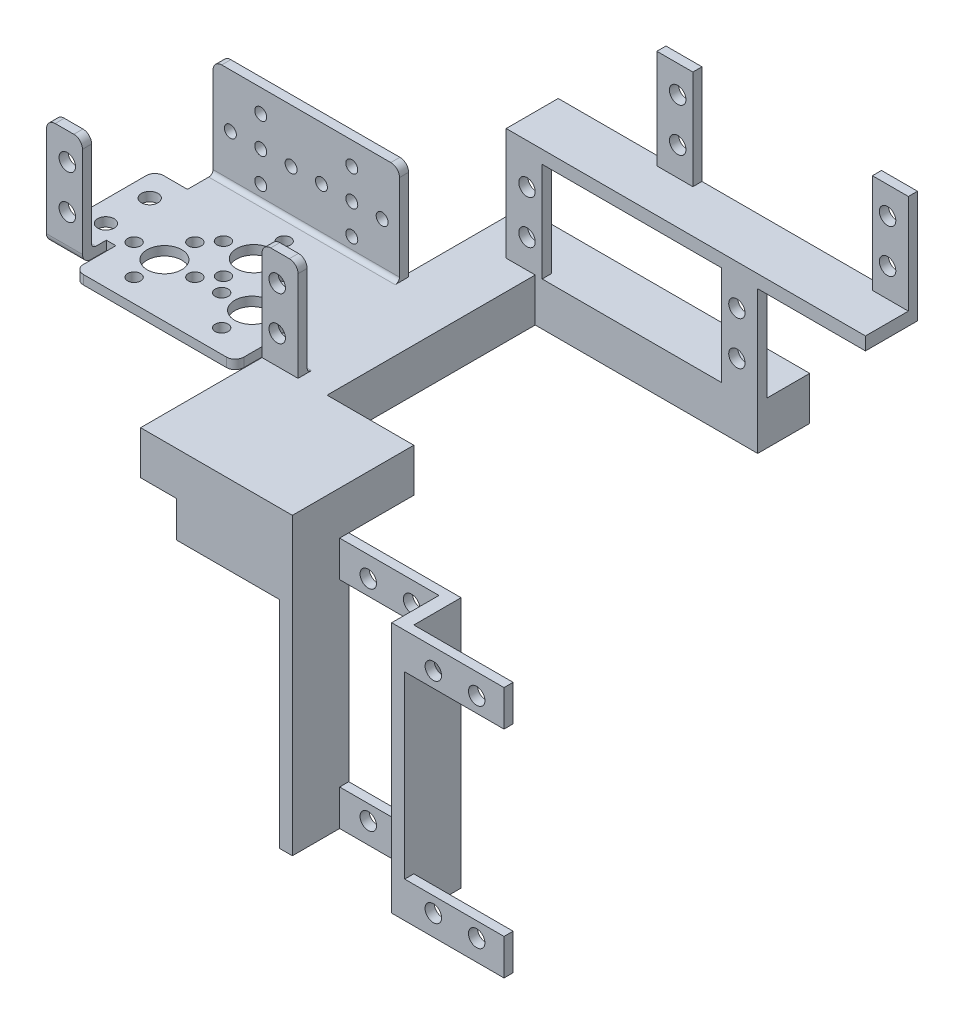
from build123d import *

# Parameters (mm, degrees)
SKETCH1_W            = 58
SKETCH1_H            = 25
BOSS_EXTRUDE1_DEPTH  = 37
SKETCH2_W            = 28.8
SKETCH2_H            = 22.9
CUT_EXTRUDE1_DEPTH   = 70.923172125
CUT_EXTRUDE2_REACH   = 50.644
SKETCH3_W            = 40.6
SKETCH3_H            = 22.9
SKETCH4_W            = 7.5
SKETCH4_H            = 8
CUT_EXTRUDE3_DEPTH   = 54.244718048
CUT_EXTRUDE4_DEPTH   = 54.244718048
SKETCH8_R            = 4
SKETCH8_R_2          = 1.5
SKETCH8_R_3          = 1.9
CUT_EXTRUDE5_DEPTH   = 53.291586321
CUT_EXTRUDE6_REACH   = 47.675
SKETCH9_R            = 1.9
CUT_EXTRUDE7_REACH   = 50.644
SKETCH10_R           = 1.375
FILLET1_R            = 2
FILLET2_R            = 1
BOSS_EXTRUDE3_DEPTH  = 10
BOSS_EXTRUDE4_DEPTH  = 58
SKETCH17_W           = 22.9
SKETCH17_H           = 41.4
CUT_EXTRUDE8_DEPTH   = 10
BOSS_EXTRUDE5_DEPTH  = 58
CUT_EXTRUDE9_REACH   = 159.514
SKETCH20_W           = 22.9
SKETCH20_H           = 41.4
CUT_EXTRUDE10_REACH  = 153.694
SKETCH18_R           = 1.9
CUT_EXTRUDE11_REACH  = 159.514
SKETCH23_R           = 1.9
SKETCH24_W           = 8.3
SKETCH24_H           = 22.9
SKETCH24_R           = 1.88285339
SKETCH24_R_2         = 1.9
BOSS_EXTRUDE6_DEPTH  = 2.1
SKETCH25_W           = 23.7
SKETCH25_H           = 13
BOSS_EXTRUDE7_DEPTH  = 8.3
SKETCH26_W           = 48
SKETCH26_H           = 10
BOSS_EXTRUDE8_DEPTH  = 6.7
SKETCH33_W           = 82.85
SKETCH33_H           = 3
BOSS_EXTRUDE12_DEPTH = 12
SKETCH36_W           = 8.3
SKETCH36_H           = 22.9
SKETCH36_R           = 1.9
BOSS_EXTRUDE13_DEPTH = 2.1


with BuildPart() as part:
    # Sketch1 → Boss-Extrude1 (new body)
    with BuildSketch(Plane.XY):
        Rectangle(SKETCH1_W, SKETCH1_H)
    extrude(amount=BOSS_EXTRUDE1_DEPTH)

    # Sketch2 → Cut-Extrude1 (cut, through all)
    with BuildSketch(Plane.ZY.offset(29)):
        with Locations((16.5, 1.05)):
            Rectangle(SKETCH2_W, SKETCH2_H)
    extrude(amount=-CUT_EXTRUDE1_DEPTH, mode=Mode.SUBTRACT)

    # Sketch3 → Cut-Extrude2 (cut, up to next)
    with BuildSketch(Plane.XY.offset(37), mode=Mode.PRIVATE) as cut_extrude2_sk1:
        with Locations((0, 1.05)):
            Rectangle(SKETCH3_W, SKETCH3_H)
    cut_extrude2_tool1 = extrude(cut_extrude2_sk1.sketch, amount=-CUT_EXTRUDE2_REACH, mode=Mode.PRIVATE) & part.part
    add(cut_extrude2_tool1.solids().sort_by_distance((0, 1.05, 37))[0], mode=Mode.SUBTRACT)

    # Sketch4 → Cut-Extrude3 (cut, through all)
    with BuildSketch(Plane.XZ.offset(12.5)):
        with Locations((-25.25, 4)):
            Rectangle(SKETCH4_W, SKETCH4_H)
        with Locations((25.25, 4)):
            Rectangle(SKETCH4_W, SKETCH4_H)
    extrude(amount=-CUT_EXTRUDE3_DEPTH, mode=Mode.SUBTRACT)

    # Sketch7 → Cut-Extrude4 (cut, through all)
    with BuildSketch(Plane.XZ.offset(12.5)):
        Polygon((-29, 37), (-18.5, 37), (-18.5, 33), (-18.5, 27.5), (-20.7, 27.5), (-20.7, 33), (-29, 33), align=None)
        Polygon((29, 37), (18.5, 37), (18.5, 33), (18.5, 27.5), (20.7, 27.5), (20.7, 33), (29, 33), align=None)
    extrude(amount=-CUT_EXTRUDE4_DEPTH, mode=Mode.SUBTRACT)

    # Sketch8 → Cut-Extrude5 (cut, through all)
    with BuildSketch(Plane(origin=(0, -10.4, 0), x_dir=(-1, 0, 0), z_dir=(0, 1, 0))):
        with Locations(Location((0, 14.2, 0), (0, 0, 90))):
            Circle(SKETCH8_R)
        with Locations(Location((7, 14.2, 0), (0, 0, 90))):
            Circle(SKETCH8_R_2)
        with Locations(Location((-7, 14.2, 0), (0, 0, 90))):
            Circle(SKETCH8_R_2)
        with Locations(Location((0, 7.2, 0), (0, 0, 90))):
            Circle(SKETCH8_R_2)
        with Locations(Location((0, 21.2, 0), (0, 0, 90))):
            Circle(SKETCH8_R_2)
        with Locations(Location((10.1, 24.7, 0), (0, 0, 90))):
            Circle(SKETCH8_R)
        with Locations(Location((17.1, 24.7, 0), (0, 0, 90))):
            Circle(SKETCH8_R_2)
        with Locations(Location((3.1, 24.7, 0), (0, 0, 90))):
            Circle(SKETCH8_R_2)
        with Locations(Location((10.1, 17.7, 0), (0, 0, 90))):
            Circle(SKETCH8_R_2)
        with Locations(Location((10.1, 31.7, 0), (0, 0, 90))):
            Circle(SKETCH8_R_2)
        with Locations(Location((-10.1, 24.7, 0), (0, 0, 90))):
            Circle(SKETCH8_R)
        with Locations(Location((-3.1, 24.7, 0), (0, 0, 90))):
            Circle(SKETCH8_R_2)
        with Locations(Location((-17.1, 24.7, 0), (0, 0, 90))):
            Circle(SKETCH8_R_2)
        with Locations(Location((-10.1, 17.7, 0), (0, 0, 90))):
            Circle(SKETCH8_R_2)
        with Locations(Location((-10.1, 31.7, 0), (0, 0, 90))):
            Circle(SKETCH8_R_2)
        with Locations(Location((24.1, 24.2, 0), (0, 0, 90))):
            Circle(SKETCH8_R_3)
        with Locations(Location((24.1, 14.1, 0), (0, 0, 90))):
            Circle(SKETCH8_R_3)
        with Locations(Location((-24.1, 14.1, 0), (0, 0, 90))):
            Circle(SKETCH8_R_3)
        with Locations(Location((-24.1, 24.2, 0), (0, 0, 90))):
            Circle(SKETCH8_R_3)
    extrude(amount=-CUT_EXTRUDE5_DEPTH, mode=Mode.SUBTRACT)

    # Sketch9 → Cut-Extrude6 (cut, up to next)
    with BuildSketch(Plane.XY.offset(33), mode=Mode.PRIVATE) as cut_extrude6_sk1:
        with Locations((-24.2, 6.2)):
            Circle(SKETCH9_R)
    cut_extrude6_tool1 = extrude(cut_extrude6_sk1.sketch, amount=-CUT_EXTRUDE6_REACH, mode=Mode.PRIVATE) & part.part
    # Sketch9 → Cut-Extrude6 (cut, up to next)
    with BuildSketch(Plane.XY.offset(33), mode=Mode.PRIVATE) as cut_extrude6_sk2:
        with Locations((-24.2, -3.8)):
            Circle(SKETCH9_R)
    cut_extrude6_tool2 = extrude(cut_extrude6_sk2.sketch, amount=-CUT_EXTRUDE6_REACH, mode=Mode.PRIVATE) & part.part
    # Sketch9 → Cut-Extrude6 (cut, up to next)
    with BuildSketch(Plane.XY.offset(33), mode=Mode.PRIVATE) as cut_extrude6_sk3:
        with Locations((24.2, 6.2)):
            Circle(SKETCH9_R)
    cut_extrude6_tool3 = extrude(cut_extrude6_sk3.sketch, amount=-CUT_EXTRUDE6_REACH, mode=Mode.PRIVATE) & part.part
    # Sketch9 → Cut-Extrude6 (cut, up to next)
    with BuildSketch(Plane.XY.offset(33), mode=Mode.PRIVATE) as cut_extrude6_sk4:
        with Locations((24.2, -3.8)):
            Circle(SKETCH9_R)
    cut_extrude6_tool4 = extrude(cut_extrude6_sk4.sketch, amount=-CUT_EXTRUDE6_REACH, mode=Mode.PRIVATE) & part.part
    add(cut_extrude6_tool1.solids().sort_by_distance((-24.2, 6.2, 33))[0], mode=Mode.SUBTRACT)
    add(cut_extrude6_tool2.solids().sort_by_distance((-24.2, -3.8, 33))[0], mode=Mode.SUBTRACT)
    add(cut_extrude6_tool3.solids().sort_by_distance((24.2, 6.2, 33))[0], mode=Mode.SUBTRACT)
    add(cut_extrude6_tool4.solids().sort_by_distance((24.2, -3.8, 33))[0], mode=Mode.SUBTRACT)

    # Sketch10 → Cut-Extrude7 (cut, up to next)
    with BuildSketch(Plane(origin=(0, 0, 0), x_dir=(-1, 0, 0), z_dir=(0, 0, -1)), mode=Mode.PRIVATE) as cut_extrude7_sk1:
        with Locations((-17.5, 0.22)):
            Circle(SKETCH10_R)
    cut_extrude7_tool1 = extrude(cut_extrude7_sk1.sketch, amount=-CUT_EXTRUDE7_REACH, mode=Mode.PRIVATE) & part.part
    # Sketch10 → Cut-Extrude7 (cut, up to next)
    with BuildSketch(Plane(origin=(0, 0, 0), x_dir=(-1, 0, 0), z_dir=(0, 0, -1)), mode=Mode.PRIVATE) as cut_extrude7_sk2:
        with Locations((-10.5, 0.22)):
            Circle(SKETCH10_R)
    cut_extrude7_tool2 = extrude(cut_extrude7_sk2.sketch, amount=-CUT_EXTRUDE7_REACH, mode=Mode.PRIVATE) & part.part
    # Sketch10 → Cut-Extrude7 (cut, up to next)
    with BuildSketch(Plane(origin=(0, 0, 0), x_dir=(-1, 0, 0), z_dir=(0, 0, -1)), mode=Mode.PRIVATE) as cut_extrude7_sk3:
        with Locations((-3.5, 0.22)):
            Circle(SKETCH10_R)
    cut_extrude7_tool3 = extrude(cut_extrude7_sk3.sketch, amount=-CUT_EXTRUDE7_REACH, mode=Mode.PRIVATE) & part.part
    # Sketch10 → Cut-Extrude7 (cut, up to next)
    with BuildSketch(Plane(origin=(0, 0, 0), x_dir=(-1, 0, 0), z_dir=(0, 0, -1)), mode=Mode.PRIVATE) as cut_extrude7_sk4:
        with Locations((3.5, 0.22)):
            Circle(SKETCH10_R)
    cut_extrude7_tool4 = extrude(cut_extrude7_sk4.sketch, amount=-CUT_EXTRUDE7_REACH, mode=Mode.PRIVATE) & part.part
    # Sketch10 → Cut-Extrude7 (cut, up to next)
    with BuildSketch(Plane(origin=(0, 0, 0), x_dir=(-1, 0, 0), z_dir=(0, 0, -1)), mode=Mode.PRIVATE) as cut_extrude7_sk5:
        with Locations((10.5, 0.22)):
            Circle(SKETCH10_R)
    cut_extrude7_tool5 = extrude(cut_extrude7_sk5.sketch, amount=-CUT_EXTRUDE7_REACH, mode=Mode.PRIVATE) & part.part
    # Sketch10 → Cut-Extrude7 (cut, up to next)
    with BuildSketch(Plane(origin=(0, 0, 0), x_dir=(-1, 0, 0), z_dir=(0, 0, -1)), mode=Mode.PRIVATE) as cut_extrude7_sk6:
        with Locations((17.5, 0.22)):
            Circle(SKETCH10_R)
    cut_extrude7_tool6 = extrude(cut_extrude7_sk6.sketch, amount=-CUT_EXTRUDE7_REACH, mode=Mode.PRIVATE) & part.part
    # Sketch10 → Cut-Extrude7 (cut, up to next)
    with BuildSketch(Plane(origin=(0, 0, 0), x_dir=(-1, 0, 0), z_dir=(0, 0, -1)), mode=Mode.PRIVATE) as cut_extrude7_sk7:
        with Locations((-10.5, 7.22)):
            Circle(SKETCH10_R)
    cut_extrude7_tool7 = extrude(cut_extrude7_sk7.sketch, amount=-CUT_EXTRUDE7_REACH, mode=Mode.PRIVATE) & part.part
    # Sketch10 → Cut-Extrude7 (cut, up to next)
    with BuildSketch(Plane(origin=(0, 0, 0), x_dir=(-1, 0, 0), z_dir=(0, 0, -1)), mode=Mode.PRIVATE) as cut_extrude7_sk8:
        with Locations((10.5, 7.22)):
            Circle(SKETCH10_R)
    cut_extrude7_tool8 = extrude(cut_extrude7_sk8.sketch, amount=-CUT_EXTRUDE7_REACH, mode=Mode.PRIVATE) & part.part
    # Sketch10 → Cut-Extrude7 (cut, up to next)
    with BuildSketch(Plane(origin=(0, 0, 0), x_dir=(-1, 0, 0), z_dir=(0, 0, -1)), mode=Mode.PRIVATE) as cut_extrude7_sk9:
        with Locations((-10.5, -6.78)):
            Circle(SKETCH10_R)
    cut_extrude7_tool9 = extrude(cut_extrude7_sk9.sketch, amount=-CUT_EXTRUDE7_REACH, mode=Mode.PRIVATE) & part.part
    # Sketch10 → Cut-Extrude7 (cut, up to next)
    with BuildSketch(Plane(origin=(0, 0, 0), x_dir=(-1, 0, 0), z_dir=(0, 0, -1)), mode=Mode.PRIVATE) as cut_extrude7_sk10:
        with Locations((10.5, -6.78)):
            Circle(SKETCH10_R)
    cut_extrude7_tool10 = extrude(cut_extrude7_sk10.sketch, amount=-CUT_EXTRUDE7_REACH, mode=Mode.PRIVATE) & part.part
    add(cut_extrude7_tool1.solids().sort_by_distance((17.5, 0.22, 0))[0], mode=Mode.SUBTRACT)
    add(cut_extrude7_tool2.solids().sort_by_distance((10.5, 0.22, 0))[0], mode=Mode.SUBTRACT)
    add(cut_extrude7_tool3.solids().sort_by_distance((3.5, 0.22, 0))[0], mode=Mode.SUBTRACT)
    add(cut_extrude7_tool4.solids().sort_by_distance((-3.5, 0.22, 0))[0], mode=Mode.SUBTRACT)
    add(cut_extrude7_tool5.solids().sort_by_distance((-10.5, 0.22, 0))[0], mode=Mode.SUBTRACT)
    add(cut_extrude7_tool6.solids().sort_by_distance((-17.5, 0.22, 0))[0], mode=Mode.SUBTRACT)
    add(cut_extrude7_tool7.solids().sort_by_distance((10.5, 7.22, 0))[0], mode=Mode.SUBTRACT)
    add(cut_extrude7_tool8.solids().sort_by_distance((-10.5, 7.22, 0))[0], mode=Mode.SUBTRACT)
    add(cut_extrude7_tool9.solids().sort_by_distance((10.5, -6.78, 0))[0], mode=Mode.SUBTRACT)
    add(cut_extrude7_tool10.solids().sort_by_distance((-10.5, -6.78, 0))[0], mode=Mode.SUBTRACT)

    # Fillet1
    fillet1_edges = [part.edges().sort_by_distance(p)[0] for p in [
        (-29, 12.5, 31.95),
        (29, 12.5, 31.95),
        (-18.5, -11.45, 37),
        (-20.7, 12.5, 31.95),
        (-24.85, -12.5, 33),
        (20.7, 12.5, 31.95),
        (18.5, -11.45, 37),
        (24.85, -12.5, 33),
        (0, -12.5, 0),
        (-29, -11.45, 8),
        (-21.5, 12.5, 1.05),
        (29, -11.45, 8),
        (21.5, 12.5, 1.05),
    ]]
    fillet(fillet1_edges, radius=FILLET1_R)

    # Fillet2
    fillet2_edges = [part.edges().sort_by_distance(p)[0] for p in [
        (-24.85, -10.4, 30.9),
        (24.85, -10.4, 30.9),
        (0, -10.4, 2.1),
    ]]
    fillet(fillet2_edges, radius=FILLET2_R)

    # Sketch15 → Boss-Extrude3 (add)
    with BuildSketch(Plane(origin=(0, -10.4, 0), x_dir=(1, 0, 0), z_dir=(0, 1, 0))):
        Polygon((20.7, 27), (87, 27), (87, 15), (29, 15), (29, -33), (52.7, -33), (55.7, -33), (55.7, -61), (52.7, -61), (20.7, -61), align=None)
    extrude(amount=-BOSS_EXTRUDE3_DEPTH)

    # Sketch16 → Boss-Extrude4 (add)
    with BuildSketch(Plane(origin=(0, -20.4, 0), x_dir=(1, 0, 0), z_dir=(0, 1, 0))):
        Polygon((52.7, -48), (78.6, -48), (78.6, -50.1), (55.7, -50.1), (55.7, -61), (52.7, -61), align=None)
    extrude(amount=-BOSS_EXTRUDE4_DEPTH)

    # Sketch17 → Cut-Extrude8 (cut)
    with BuildSketch(Plane.XY.offset(50.1)):
        with Locations((67.15, -49.4)):
            Rectangle(SKETCH17_W, SKETCH17_H)
    extrude(amount=-CUT_EXTRUDE8_DEPTH, mode=Mode.SUBTRACT)

    # Sketch19 → Boss-Extrude5 (add)
    with BuildSketch(Plane(origin=(0, -20.4, 0), x_dir=(1, 0, 0), z_dir=(0, 1, 0))):
        Polygon((78.6, -48), (78.6, -61), (81.6, -61), (104.5, -61), (104.5, -58.9), (81.6, -58.9), (81.6, -48), align=None)
    extrude(amount=-BOSS_EXTRUDE5_DEPTH)

    # Sketch20 → Cut-Extrude9 (cut, up to next)
    with BuildSketch(Plane.XY.offset(61), mode=Mode.PRIVATE) as cut_extrude9_sk1:
        with Locations((93.05, -49.4)):
            Rectangle(SKETCH20_W, SKETCH20_H)
    cut_extrude9_tool1 = extrude(cut_extrude9_sk1.sketch, amount=-CUT_EXTRUDE9_REACH, mode=Mode.PRIVATE) & part.part
    add(cut_extrude9_tool1.solids().sort_by_distance((93.05, -49.4, 61))[0], mode=Mode.SUBTRACT)

    # Sketch18 → Cut-Extrude10 (cut, up to next)
    with BuildSketch(Plane.XY.offset(50.1), mode=Mode.PRIVATE) as cut_extrude10_sk1:
        with Locations((72.3, -25.2)):
            Circle(SKETCH18_R)
    cut_extrude10_tool1 = extrude(cut_extrude10_sk1.sketch, amount=-CUT_EXTRUDE10_REACH, mode=Mode.PRIVATE) & part.part
    # Sketch18 → Cut-Extrude10 (cut, up to next)
    with BuildSketch(Plane.XY.offset(50.1), mode=Mode.PRIVATE) as cut_extrude10_sk2:
        with Locations((62.3, -25.2)):
            Circle(SKETCH18_R)
    cut_extrude10_tool2 = extrude(cut_extrude10_sk2.sketch, amount=-CUT_EXTRUDE10_REACH, mode=Mode.PRIVATE) & part.part
    # Sketch18 → Cut-Extrude10 (cut, up to next)
    with BuildSketch(Plane.XY.offset(50.1), mode=Mode.PRIVATE) as cut_extrude10_sk3:
        with Locations((72.3, -73.6)):
            Circle(SKETCH18_R)
    cut_extrude10_tool3 = extrude(cut_extrude10_sk3.sketch, amount=-CUT_EXTRUDE10_REACH, mode=Mode.PRIVATE) & part.part
    # Sketch18 → Cut-Extrude10 (cut, up to next)
    with BuildSketch(Plane.XY.offset(50.1), mode=Mode.PRIVATE) as cut_extrude10_sk4:
        with Locations((62.3, -73.6)):
            Circle(SKETCH18_R)
    cut_extrude10_tool4 = extrude(cut_extrude10_sk4.sketch, amount=-CUT_EXTRUDE10_REACH, mode=Mode.PRIVATE) & part.part
    add(cut_extrude10_tool1.solids().sort_by_distance((72.3, -25.2, 50.1))[0], mode=Mode.SUBTRACT)
    add(cut_extrude10_tool2.solids().sort_by_distance((62.3, -25.2, 50.1))[0], mode=Mode.SUBTRACT)
    add(cut_extrude10_tool3.solids().sort_by_distance((72.3, -73.6, 50.1))[0], mode=Mode.SUBTRACT)
    add(cut_extrude10_tool4.solids().sort_by_distance((62.3, -73.6, 50.1))[0], mode=Mode.SUBTRACT)

    # Sketch23 → Cut-Extrude11 (cut, up to next)
    with BuildSketch(Plane.XY.offset(61), mode=Mode.PRIVATE) as cut_extrude11_sk1:
        with Locations((98.2, -25.2)):
            Circle(SKETCH23_R)
    cut_extrude11_tool1 = extrude(cut_extrude11_sk1.sketch, amount=-CUT_EXTRUDE11_REACH, mode=Mode.PRIVATE) & part.part
    # Sketch23 → Cut-Extrude11 (cut, up to next)
    with BuildSketch(Plane.XY.offset(61), mode=Mode.PRIVATE) as cut_extrude11_sk2:
        with Locations((88.2, -25.2)):
            Circle(SKETCH23_R)
    cut_extrude11_tool2 = extrude(cut_extrude11_sk2.sketch, amount=-CUT_EXTRUDE11_REACH, mode=Mode.PRIVATE) & part.part
    # Sketch23 → Cut-Extrude11 (cut, up to next)
    with BuildSketch(Plane.XY.offset(61), mode=Mode.PRIVATE) as cut_extrude11_sk3:
        with Locations((88.2, -73.6)):
            Circle(SKETCH23_R)
    cut_extrude11_tool3 = extrude(cut_extrude11_sk3.sketch, amount=-CUT_EXTRUDE11_REACH, mode=Mode.PRIVATE) & part.part
    # Sketch23 → Cut-Extrude11 (cut, up to next)
    with BuildSketch(Plane.XY.offset(61), mode=Mode.PRIVATE) as cut_extrude11_sk4:
        with Locations((98.2, -73.6)):
            Circle(SKETCH23_R)
    cut_extrude11_tool4 = extrude(cut_extrude11_sk4.sketch, amount=-CUT_EXTRUDE11_REACH, mode=Mode.PRIVATE) & part.part
    add(cut_extrude11_tool1.solids().sort_by_distance((98.2, -25.2, 61))[0], mode=Mode.SUBTRACT)
    add(cut_extrude11_tool2.solids().sort_by_distance((88.2, -25.2, 61))[0], mode=Mode.SUBTRACT)
    add(cut_extrude11_tool3.solids().sort_by_distance((88.2, -73.6, 61))[0], mode=Mode.SUBTRACT)
    add(cut_extrude11_tool4.solids().sort_by_distance((98.2, -73.6, 61))[0], mode=Mode.SUBTRACT)

    # Sketch24 → Boss-Extrude6 (add)
    # profile 1 of 2: a face of its own
    with BuildSketch(Plane.XY.offset(-15)):
        with Locations((82.85, 1.05)):
            Rectangle(SKETCH24_W, SKETCH24_H)
        with Locations((82.2, 6.2)):
            Circle(SKETCH24_R, mode=Mode.SUBTRACT)
        with Locations((82.2, -3.8)):
            Circle(SKETCH24_R, mode=Mode.SUBTRACT)
    # profile 2 of 2: a face of its own
    with BuildSketch(Plane.XY.offset(-15)):
        with Locations((33.15, 1.05)):
            Rectangle(SKETCH24_W, SKETCH24_H)
        with Locations((33.8, 6.2)):
            Circle(SKETCH24_R_2, mode=Mode.SUBTRACT)
        with Locations((33.8, -3.8)):
            Circle(SKETCH24_R_2, mode=Mode.SUBTRACT)
    extrude(amount=-BOSS_EXTRUDE6_DEPTH)

    # Sketch25 → Boss-Extrude7 (add)
    with BuildSketch(Plane.XZ.offset(20.4)):
        with Locations((40.85, 54.5)):
            Rectangle(SKETCH25_W, SKETCH25_H)
    extrude(amount=BOSS_EXTRUDE7_DEPTH)

    # Sketch26 → Boss-Extrude8 (add)
    with BuildSketch(Plane(origin=(29, 0, 0), x_dir=(0, 0, -1), z_dir=(1, 0, 0))):
        with Locations((-9, -15.4)):
            Rectangle(SKETCH26_W, SKETCH26_H)
    extrude(amount=BOSS_EXTRUDE8_DEPTH)

    # Sketch33 → Boss-Extrude12 (add)
    with BuildSketch(Plane.XY.offset(-15)):
        with Locations((70.425, 14)):
            Rectangle(SKETCH33_W, SKETCH33_H)
    extrude(amount=-BOSS_EXTRUDE12_DEPTH)

    # Sketch36 → Boss-Extrude13 (add)
    # profile 1 of 2: a face of its own
    with BuildSketch(Plane(origin=(0, 0, -27), x_dir=(-1, 0, 0), z_dir=(0, 0, -1))):
        with Locations((-107.7, 26.95)):
            Rectangle(SKETCH36_W, SKETCH36_H)
        with Locations((-107.05, 32.1)):
            Circle(SKETCH36_R, mode=Mode.SUBTRACT)
        with Locations((-107.05, 22.1)):
            Circle(SKETCH36_R, mode=Mode.SUBTRACT)
    # profile 2 of 2: a face of its own
    with BuildSketch(Plane(origin=(0, 0, -27), x_dir=(-1, 0, 0), z_dir=(0, 0, -1))):
        with Locations((-58, 26.95)):
            Rectangle(SKETCH36_W, SKETCH36_H)
        with Locations((-58.65, 32.1)):
            Circle(SKETCH36_R, mode=Mode.SUBTRACT)
        with Locations((-58.65, 22.1)):
            Circle(SKETCH36_R, mode=Mode.SUBTRACT)
    extrude(amount=-BOSS_EXTRUDE13_DEPTH)


solid = part.part
